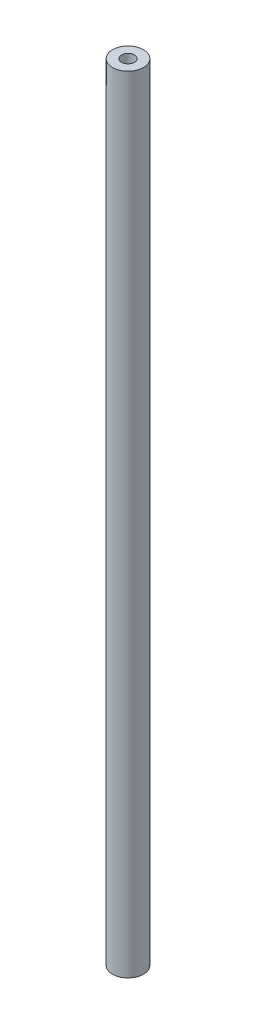
from build123d import *

# Parameters (mm, degrees)
SKETCH1_R           = 6
SKETCH1_R_2         = 2.5
BOSS_EXTRUDE1_DEPTH = 152.4


with BuildPart() as part:
    # Sketch1 → Boss-Extrude1 (new, symmetric)
    with BuildSketch(Plane(origin=(0, 0, 0), x_dir=(1, 0, 0), z_dir=(0, 1, 0))):
        with Locations(Location((0, 0, 0), (0, 0, 90))):
            Circle(SKETCH1_R)
        with Locations(Location((0, 0, 0), (0, 0, 90))):
            Circle(SKETCH1_R_2, mode=Mode.SUBTRACT)
    extrude(amount=BOSS_EXTRUDE1_DEPTH, both=True)


solid = part.part
